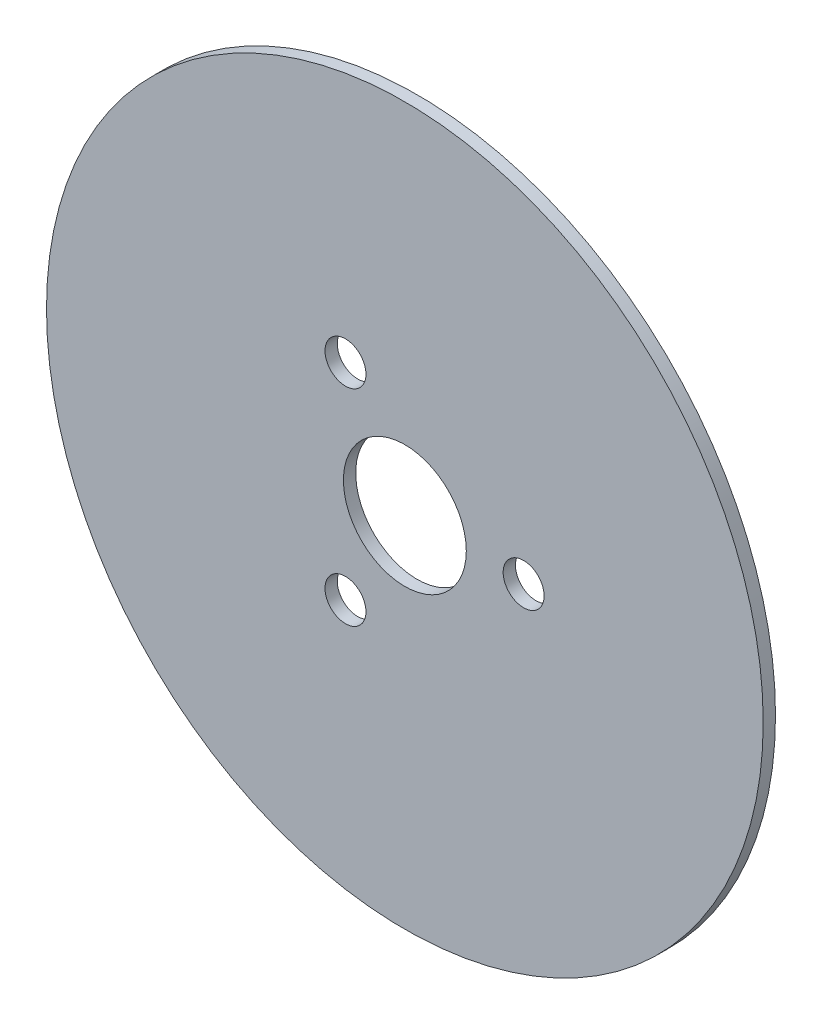
from build123d import *

# Parameters (mm, degrees)
SKETCH1_R           = 87.5
SKETCH1_R_2         = 5
SKETCH1_R_3         = 15
BOSS_EXTRUDE1_DEPTH = 3


with BuildPart() as part:
    # Sketch1 → Boss-Extrude1 (new body)
    with BuildSketch(Plane.XY):
        Circle(SKETCH1_R)
        with Locations((29, 0)):
            Circle(SKETCH1_R_2, mode=Mode.SUBTRACT)
        with Locations((-14.5, -25.11473671)):
            Circle(SKETCH1_R_2, mode=Mode.SUBTRACT)
        with Locations((-14.5, 25.11473671)):
            Circle(SKETCH1_R_2, mode=Mode.SUBTRACT)
        Circle(SKETCH1_R_3, mode=Mode.SUBTRACT)
    extrude(amount=BOSS_EXTRUDE1_DEPTH)


solid = part.part
